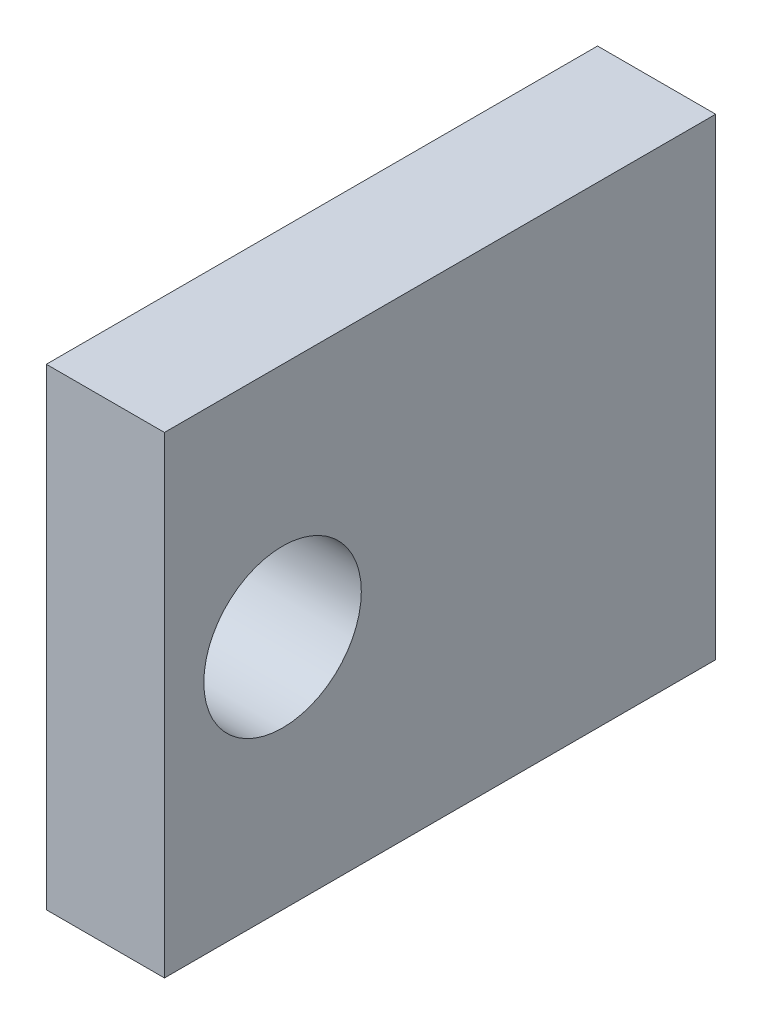
from build123d import *

# Parameters (mm, degrees)
SKETCH1_W           = 44.45
SKETCH1_H           = 38.1
SKETCH1_R           = 6.35
BOSS_EXTRUDE1_DEPTH = 9.525


with BuildPart() as part:
    # Sketch1 → Boss-Extrude1 (new body)
    with BuildSketch(Plane(origin=(0, 0, 0), x_dir=(0, 0, -1), z_dir=(1, 0, 0))):
        Rectangle(SKETCH1_W, SKETCH1_H)
        with Locations(Location((-12.7, 0, 0), (0, 0, 180))):
            Circle(SKETCH1_R, mode=Mode.SUBTRACT)
    extrude(amount=BOSS_EXTRUDE1_DEPTH)


solid = part.part
